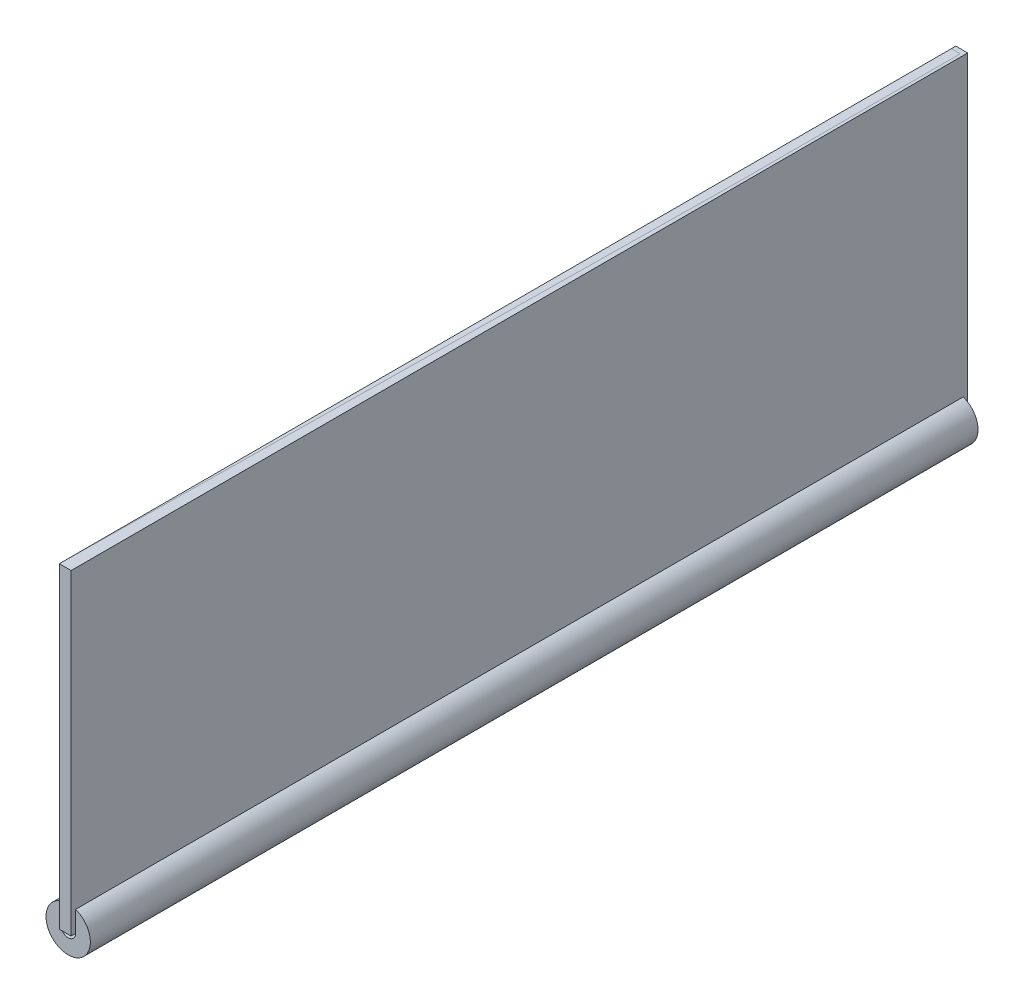
from build123d import *

# Parameters (mm, degrees)
SCHIZZO7_W                   = 300
SCHIZZO7_H                   = 107
ESTRUSIONE_ESTRUSIONE4_DEPTH = 3
SCHIZZO8_R                   = 7.5
SCHIZZO9_R                   = 2.5
TAGLIO_ESTRUSIONE1_DEPTH     = 307.271121721
SCHIZZO11_W                  = 303
SCHIZZO11_H                  = 107
ESTRUSIONE_ESTRUSIONE5_DEPTH = 4


with BuildPart() as part:
    # Schizzo7 → Estrusione-Estrusione4 (new body)
    with BuildSketch(Plane(origin=(0, 0, 0), x_dir=(0, 0, -1), z_dir=(1, 0, 0))):
        Rectangle(SCHIZZO7_W, SCHIZZO7_H)
    extrude(amount=ESTRUSIONE_ESTRUSIONE4_DEPTH)

    # Sweep2: sweep along a curve in space
    with BuildLine() as sweep2_path:
        Line((3, -53.5, 150), (3, -53.5, -150))
    # Schizzo8 → Sweep2 (sweep)
    with BuildSketch(Plane.XY.offset(150)):
        with Locations((1.5, -53.5)):
            Circle(SCHIZZO8_R)
    sweep(path=sweep2_path.line)

    # Schizzo9 → Taglio-Estrusione1 (cut, through all)
    with BuildSketch(Plane.XY.offset(150)):
        with Locations((1.5, -53.5)):
            Circle(SCHIZZO9_R)
    extrude(amount=-TAGLIO_ESTRUSIONE1_DEPTH, mode=Mode.SUBTRACT)


with BuildPart() as body_2:
    # Schizzo11 → Estrusione-Estrusione5 (new body)
    with BuildSketch(Plane(origin=(0, 0, 0), x_dir=(0, 0, -1), z_dir=(1, 0, 0))):
        Rectangle(SCHIZZO11_W, SCHIZZO11_H)
    extrude(amount=ESTRUSIONE_ESTRUSIONE5_DEPTH)


solid = Compound([part.part, body_2.part])
